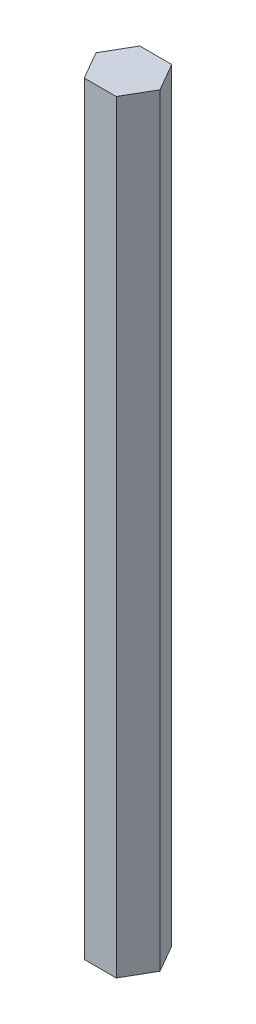
from build123d import *

# Parameters (mm, degrees)
BOSS_EXTRUDE1_DEPTH = 100


with BuildPart() as part:
    # Sketch1 → Boss-Extrude1 (new body)
    with BuildSketch(Plane(origin=(0, 0, 0), x_dir=(1, 0, 0), z_dir=(0, 1, 0))):
        Polygon((2.0975, 3.632976569), (-2.0975, 3.632976569), (-4.195, 0), (-2.0975, -3.632976569), (2.0975, -3.632976569), (4.195, 0), align=None)
    extrude(amount=-BOSS_EXTRUDE1_DEPTH)


solid = part.part
